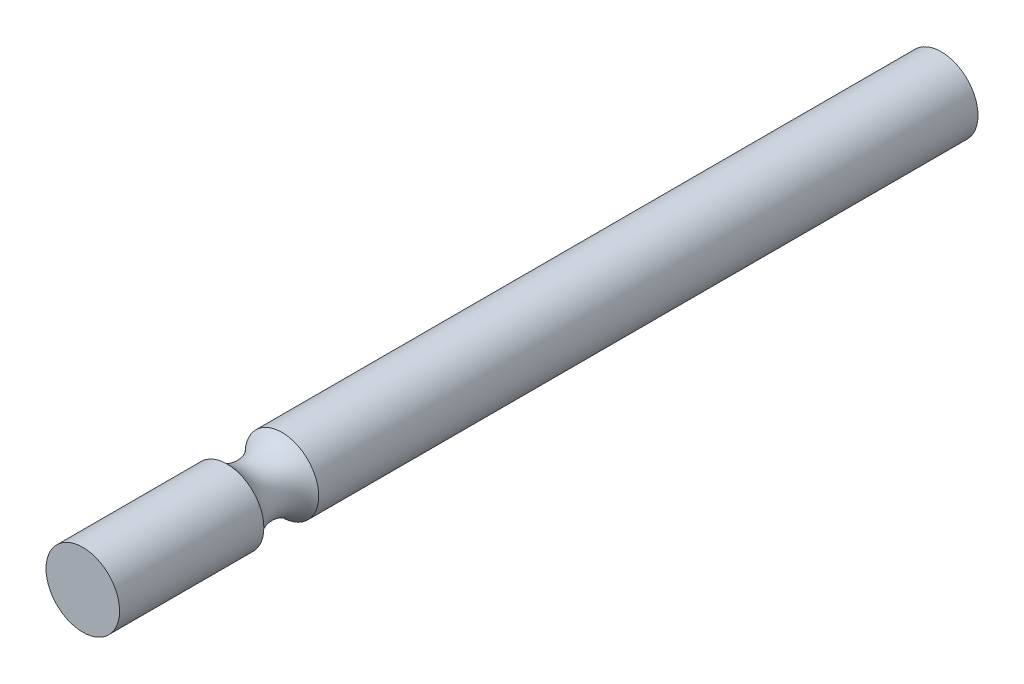
from build123d import *

# Parameters (mm, degrees)
SKETCH_1_R      = 1.5
EXTRUDE_1_DEPTH = 35


with BuildPart() as part:
    # 草图1 → 凸台-拉伸1 (new body)
    with BuildSketch(Plane.XY):
        Circle(SKETCH_1_R)
    extrude(amount=EXTRUDE_1_DEPTH)

    # 草图2 → 切除-旋转1 (revolve, cut)
    with BuildSketch(Plane(origin=(0, 0, 0), x_dir=(0, 0, -1), z_dir=(1, 0, 0)), mode=Mode.PRIVATE) as cut_revolve_1_sk:
        with BuildLine():
            Line((-29.5, 2.5), (-26.5, 2.5))
            ThreePointArc((-26.5, 2.5), (-28, 1), (-29.5, 2.5))
        make_face()
    revolve(cut_revolve_1_sk.sketch.rotate(Axis((0, 0, 35), (0, 0, -1)), 90), axis=Axis((0, 0, 35), (0, 0, -1)), mode=Mode.SUBTRACT)


solid = part.part
